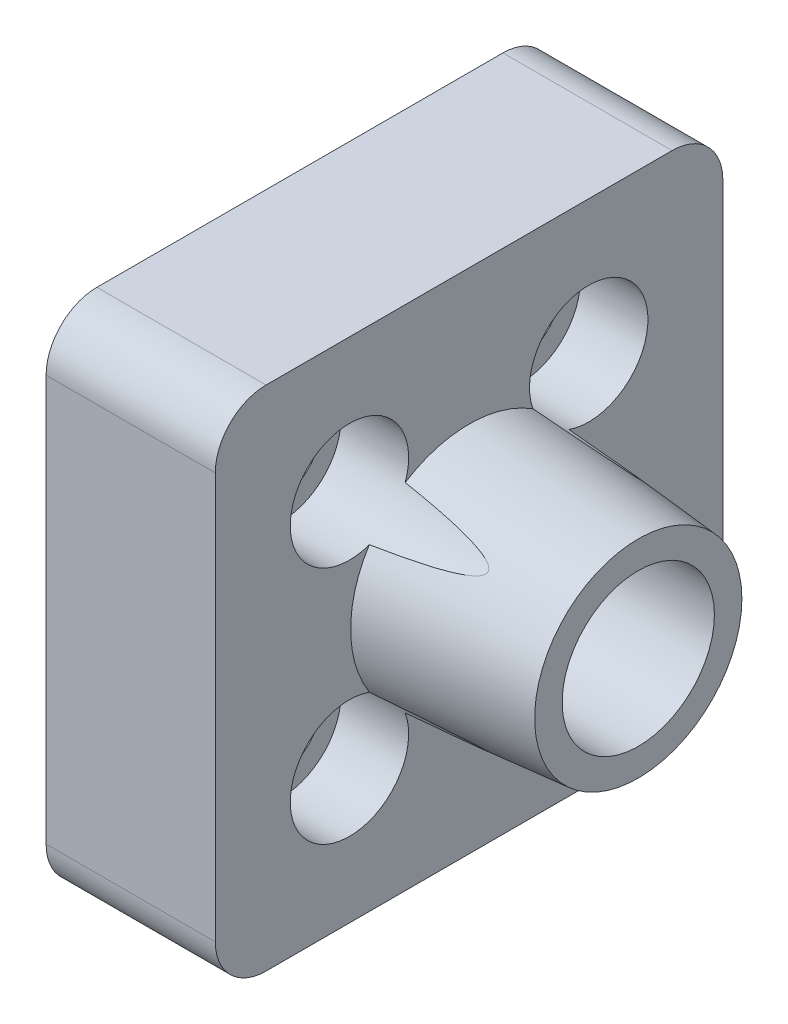
from build123d import *

# Parameters (mm, degrees)
IZIM1_W                     = 30
IZIM1_H                     = 30
IZIM1_R                     = 2.25
Y_KSEKLIK_EKSTR_ZYON1_DEPTH = 10
RADYUS1_R                   = 3
IZIM2_R                     = 7
Y_KSEKLIK_EKSTR_ZYON2_DEPTH = 10
Y_KSEKLIK_EKSTR_ZYON2_TAPER = 5
IZIM3_R                     = 4.5
KES_EKSTR_ZYON1_DEPTH       = 30.154759474
KES_S_P_R2_PROFILE_R        = 1
KES_EKSTR_ZYON2_DEPTH       = 24.452078842
KES_EKSTR_ZYON2_DEPTH_BACK  = 4
IZIM34_R                    = 3.5


with BuildPart() as part:
    # Çizim1 → Yükseklik-Ekstrüzyon1 (new body)
    with BuildSketch(Plane.YZ):
        Rectangle(IZIM1_W, IZIM1_H)
        with Locations(Location((-7.071067812, 7.071067812, 0), (0, 0, 270))):
            Circle(IZIM1_R, mode=Mode.SUBTRACT)
        with Locations(Location((7.071067812, 7.071067812, 0), (0, 0, 270))):
            Circle(IZIM1_R, mode=Mode.SUBTRACT)
        with Locations(Location((7.071067812, -7.071067812, 0), (0, 0, 270))):
            Circle(IZIM1_R, mode=Mode.SUBTRACT)
        with Locations(Location((-7.071067812, -7.071067812, 0), (0, 0, 270))):
            Circle(IZIM1_R, mode=Mode.SUBTRACT)
    extrude(amount=Y_KSEKLIK_EKSTR_ZYON1_DEPTH)

    # Radyus1
    radyus1_edges = [part.edges().sort_by_distance(p)[0] for p in [
        (5, -15, 15),
        (5, 15, 15),
        (5, 15, -15),
        (5, -15, -15),
    ]]
    fillet(radyus1_edges, radius=RADYUS1_R)

    # Çizim2 → Yükseklik-Ekstrüzyon2 (add)
    with BuildSketch(Plane.YZ.offset(10)):
        Circle(IZIM2_R)
    extrude(amount=Y_KSEKLIK_EKSTR_ZYON2_DEPTH, taper=Y_KSEKLIK_EKSTR_ZYON2_TAPER)

    # Çizim3 → Kes-Ekstrüzyon1 (cut, through all)
    with BuildSketch(Plane.YZ.offset(20)):
        with Locations(Location((0, 0, 0), (0, 0, 270))):
            Circle(IZIM3_R)
    extrude(amount=-KES_EKSTR_ZYON1_DEPTH, mode=Mode.SUBTRACT)

    # Kes-Süpür2: sweep along a path in Çizim4
    with BuildLine(Plane(origin=(0.8, 0, 0), x_dir=(0, -1, 0), z_dir=(-1, 0, 0))) as kes_s_p_r2_path:
        Line((13, -12), (13, 12))
        ThreePointArc((13, 12), (12.707106781, 12.707106781), (12, 13))
        Line((12, 13), (-12, 13))
        ThreePointArc((-12, 13), (-12.707106781, 12.707106781), (-13, 12))
        Line((-13, 12), (-13, -12))
        ThreePointArc((-13, -12), (-12.707106781, -12.707106781), (-12, -13))
        Line((-12, -13), (12, -13))
        ThreePointArc((12, -13), (12.707106781, -12.707106781), (13, -12))
    # Kes-Süpür2 profile (on start of the path) → Kes-Süpür2 (sweep, cut)
    with BuildSketch(Plane(origin=(0.8, -13, -12), x_dir=(1, 0, 0), z_dir=(0, 0, 1))):
        Circle(KES_S_P_R2_PROFILE_R)
    sweep(path=kes_s_p_r2_path.line, mode=Mode.SUBTRACT)

    # Çizim34 → Kes-Ekstrüzyon2 (cut, two sides: drawn at the far end of the back side and taken through both)
    with BuildSketch(Plane.YZ.offset(10).offset(-KES_EKSTR_ZYON2_DEPTH_BACK)):
        with Locations(Location((-7.071067812, 7.071067812, 0), (0, 0, 340.368439442))):
            Circle(IZIM34_R)
        with Locations(Location((7.071067812, 7.071067812, 0), (0, 0, 199.631561315))):
            Circle(IZIM34_R)
        with Locations(Location((7.071067812, -7.071067812, 0), (0, 0, 109.631561315))):
            Circle(IZIM34_R)
        with Locations(Location((-7.071067812, -7.071067812, 0), (0, 0, 70.368439442))):
            Circle(IZIM34_R)
    extrude(amount=KES_EKSTR_ZYON2_DEPTH + KES_EKSTR_ZYON2_DEPTH_BACK, mode=Mode.SUBTRACT)


solid = part.part
